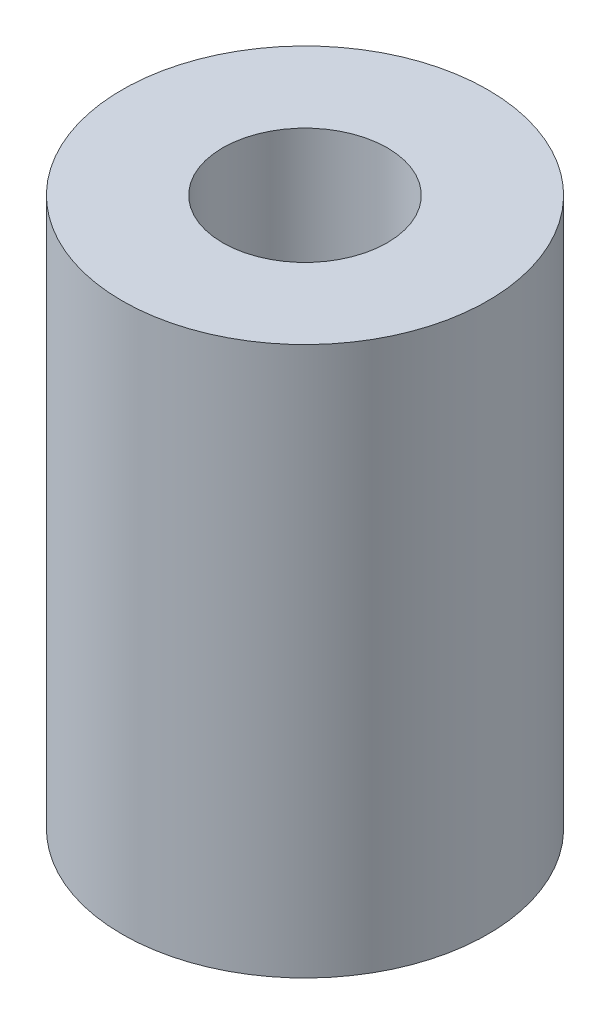
from build123d import *

# Parameters (mm, degrees)
ESQUISSE1_W = 2.75
ESQUISSE1_H = 15


with BuildPart() as part:
    # Esquisse1 → Base-Révolution (revolve)
    with BuildSketch(Plane.XY, mode=Mode.PRIVATE) as base_r_volution_sk:
        with Locations((3.625, 7.5)):
            Rectangle(ESQUISSE1_W, ESQUISSE1_H)
    revolve(base_r_volution_sk.sketch.rotate(Axis((0, 0, 0), (0, 1, 0)), 90), axis=Axis((0, 0, 0), (0, 1, 0)))


solid = part.part
